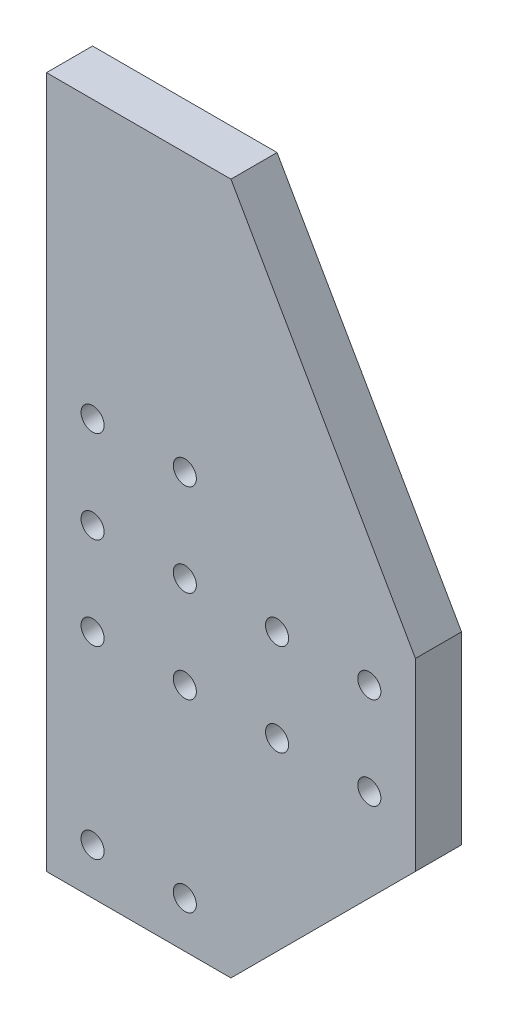
from build123d import *

# Parameters (mm, degrees)
BOSS_EXTRUDE1_DEPTH = 10
CUT_EXTRUDE1_REACH  = 172.294
SKETCH2_R           = 2.5


with BuildPart() as part:
    # Sketch1 → Boss-Extrude1 (new body)
    with BuildSketch(Plane.XY):
        Polygon((0, 0), (40, 0), (80, 40), (80, 80), (40, 150), (0, 150), align=None)
    extrude(amount=BOSS_EXTRUDE1_DEPTH)

    # Sketch2 → Cut-Extrude1 (cut, up to next)
    with BuildSketch(Plane.XY.offset(10), mode=Mode.PRIVATE) as cut_extrude1_sk1:
        with Locations((10, 10)):
            Circle(SKETCH2_R)
    cut_extrude1_tool1 = extrude(cut_extrude1_sk1.sketch, amount=-CUT_EXTRUDE1_REACH, mode=Mode.PRIVATE) & part.part
    # Sketch2 → Cut-Extrude1 (cut, up to next)
    with BuildSketch(Plane.XY.offset(10), mode=Mode.PRIVATE) as cut_extrude1_sk2:
        with Locations((30, 10)):
            Circle(SKETCH2_R)
    cut_extrude1_tool2 = extrude(cut_extrude1_sk2.sketch, amount=-CUT_EXTRUDE1_REACH, mode=Mode.PRIVATE) & part.part
    # Sketch2 → Cut-Extrude1 (cut, up to next)
    with BuildSketch(Plane.XY.offset(10), mode=Mode.PRIVATE) as cut_extrude1_sk3:
        with Locations((10, 50)):
            Circle(SKETCH2_R)
    cut_extrude1_tool3 = extrude(cut_extrude1_sk3.sketch, amount=-CUT_EXTRUDE1_REACH, mode=Mode.PRIVATE) & part.part
    # Sketch2 → Cut-Extrude1 (cut, up to next)
    with BuildSketch(Plane.XY.offset(10), mode=Mode.PRIVATE) as cut_extrude1_sk4:
        with Locations((70, 70)):
            Circle(SKETCH2_R)
    cut_extrude1_tool4 = extrude(cut_extrude1_sk4.sketch, amount=-CUT_EXTRUDE1_REACH, mode=Mode.PRIVATE) & part.part
    # Sketch2 → Cut-Extrude1 (cut, up to next)
    with BuildSketch(Plane.XY.offset(10), mode=Mode.PRIVATE) as cut_extrude1_sk5:
        with Locations((50, 70)):
            Circle(SKETCH2_R)
    cut_extrude1_tool5 = extrude(cut_extrude1_sk5.sketch, amount=-CUT_EXTRUDE1_REACH, mode=Mode.PRIVATE) & part.part
    # Sketch2 → Cut-Extrude1 (cut, up to next)
    with BuildSketch(Plane.XY.offset(10), mode=Mode.PRIVATE) as cut_extrude1_sk6:
        with Locations((50, 50)):
            Circle(SKETCH2_R)
    cut_extrude1_tool6 = extrude(cut_extrude1_sk6.sketch, amount=-CUT_EXTRUDE1_REACH, mode=Mode.PRIVATE) & part.part
    # Sketch2 → Cut-Extrude1 (cut, up to next)
    with BuildSketch(Plane.XY.offset(10), mode=Mode.PRIVATE) as cut_extrude1_sk7:
        with Locations((30, 50)):
            Circle(SKETCH2_R)
    cut_extrude1_tool7 = extrude(cut_extrude1_sk7.sketch, amount=-CUT_EXTRUDE1_REACH, mode=Mode.PRIVATE) & part.part
    # Sketch2 → Cut-Extrude1 (cut, up to next)
    with BuildSketch(Plane.XY.offset(10), mode=Mode.PRIVATE) as cut_extrude1_sk8:
        with Locations((70, 50)):
            Circle(SKETCH2_R)
    cut_extrude1_tool8 = extrude(cut_extrude1_sk8.sketch, amount=-CUT_EXTRUDE1_REACH, mode=Mode.PRIVATE) & part.part
    # Sketch2 → Cut-Extrude1 (cut, up to next)
    with BuildSketch(Plane.XY.offset(10), mode=Mode.PRIVATE) as cut_extrude1_sk9:
        with Locations((30, 90)):
            Circle(SKETCH2_R)
    cut_extrude1_tool9 = extrude(cut_extrude1_sk9.sketch, amount=-CUT_EXTRUDE1_REACH, mode=Mode.PRIVATE) & part.part
    # Sketch2 → Cut-Extrude1 (cut, up to next)
    with BuildSketch(Plane.XY.offset(10), mode=Mode.PRIVATE) as cut_extrude1_sk10:
        with Locations((10, 90)):
            Circle(SKETCH2_R)
    cut_extrude1_tool10 = extrude(cut_extrude1_sk10.sketch, amount=-CUT_EXTRUDE1_REACH, mode=Mode.PRIVATE) & part.part
    # Sketch2 → Cut-Extrude1 (cut, up to next)
    with BuildSketch(Plane.XY.offset(10), mode=Mode.PRIVATE) as cut_extrude1_sk11:
        with Locations((10, 70)):
            Circle(SKETCH2_R)
    cut_extrude1_tool11 = extrude(cut_extrude1_sk11.sketch, amount=-CUT_EXTRUDE1_REACH, mode=Mode.PRIVATE) & part.part
    # Sketch2 → Cut-Extrude1 (cut, up to next)
    with BuildSketch(Plane.XY.offset(10), mode=Mode.PRIVATE) as cut_extrude1_sk12:
        with Locations((30, 70)):
            Circle(SKETCH2_R)
    cut_extrude1_tool12 = extrude(cut_extrude1_sk12.sketch, amount=-CUT_EXTRUDE1_REACH, mode=Mode.PRIVATE) & part.part
    add(cut_extrude1_tool1.solids().sort_by_distance((10, 10, 10))[0], mode=Mode.SUBTRACT)
    add(cut_extrude1_tool2.solids().sort_by_distance((30, 10, 10))[0], mode=Mode.SUBTRACT)
    add(cut_extrude1_tool3.solids().sort_by_distance((10, 50, 10))[0], mode=Mode.SUBTRACT)
    add(cut_extrude1_tool4.solids().sort_by_distance((70, 70, 10))[0], mode=Mode.SUBTRACT)
    add(cut_extrude1_tool5.solids().sort_by_distance((50, 70, 10))[0], mode=Mode.SUBTRACT)
    add(cut_extrude1_tool6.solids().sort_by_distance((50, 50, 10))[0], mode=Mode.SUBTRACT)
    add(cut_extrude1_tool7.solids().sort_by_distance((30, 50, 10))[0], mode=Mode.SUBTRACT)
    add(cut_extrude1_tool8.solids().sort_by_distance((70, 50, 10))[0], mode=Mode.SUBTRACT)
    add(cut_extrude1_tool9.solids().sort_by_distance((30, 90, 10))[0], mode=Mode.SUBTRACT)
    add(cut_extrude1_tool10.solids().sort_by_distance((10, 90, 10))[0], mode=Mode.SUBTRACT)
    add(cut_extrude1_tool11.solids().sort_by_distance((10, 70, 10))[0], mode=Mode.SUBTRACT)
    add(cut_extrude1_tool12.solids().sort_by_distance((30, 70, 10))[0], mode=Mode.SUBTRACT)


solid = part.part
